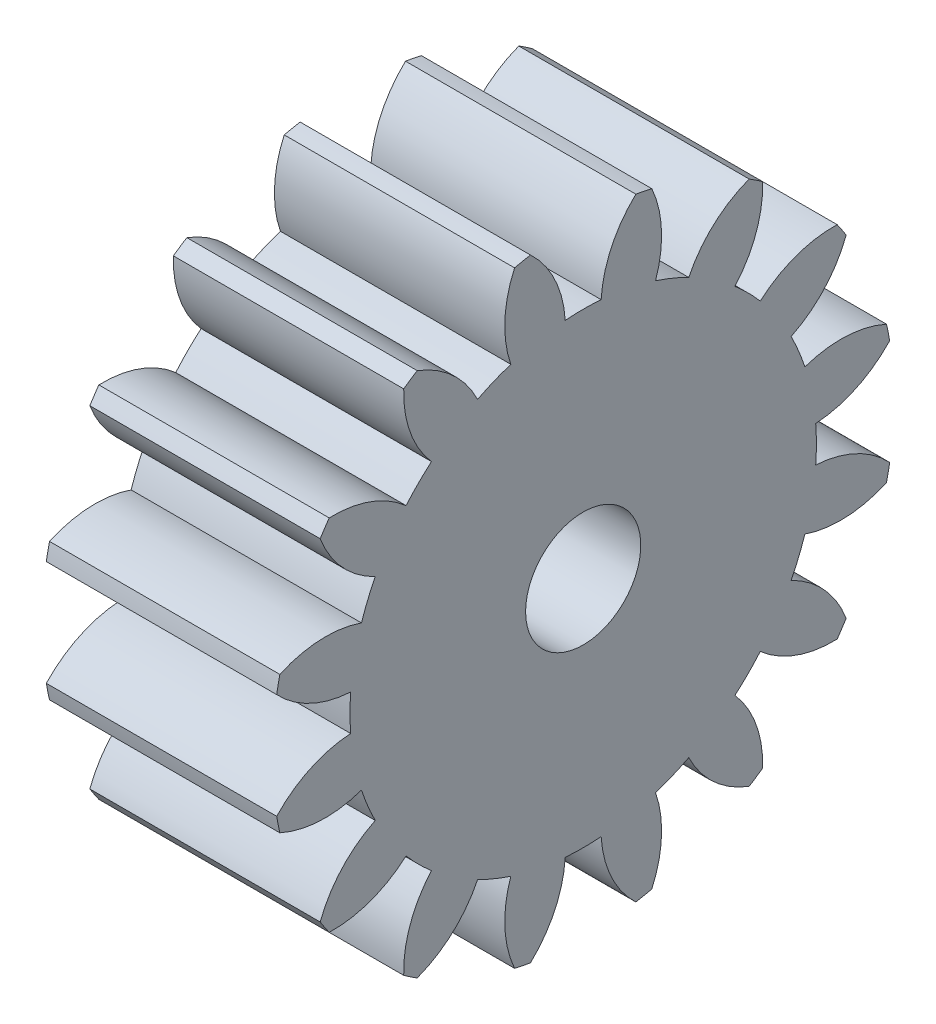
from build123d import *

# Parameters (mm, degrees)
BASPROSKE_W     = 10
BASPROSKE_H     = 13.5
TOOTHCUT_DEPTH  = 22.552262062
TEETHCUTS_COUNT = 16
TEETHCUTS_ANGLE = 337.5
BORSKE_R        = 2.5
BORE_DEPTH      = 50.0000508


with BuildPart() as part:
    # BasProSke → Base-Revolve (revolve)
    with BuildSketch(Plane(origin=(0, 0, 0), x_dir=(1, 0, 0), z_dir=(0, 1, 0)), mode=Mode.PRIVATE) as base_revolve_sk:
        with Locations((5, 6.75)):
            Rectangle(BASPROSKE_W, BASPROSKE_H)
    revolve(base_revolve_sk.sketch.rotate(Axis((-10, 0, 0), (1, 0, 0)), 180), axis=Axis((-10, 0, 0), (1, 0, 0)))

    # TooCutSke → ToothCut (cut, through all)
    with BuildSketch(Plane(origin=(0, 0, 0), x_dir=(0, 0, -1), z_dir=(1, 0, 0))):
        with BuildLine():
            ThreePointArc((0.779807897, 10.093922708), (0, 10.124), (-0.779807897, 10.093922708))
            ThreePointArc((-0.779807897, 10.093922708), (-1.232785697, 11.858156262), (-2.310463203, 13.326597651))
            ThreePointArc((-2.310463203, 13.326597651), (0, 13.5254), (2.310463203, 13.326597651))
            ThreePointArc((2.310463203, 13.326597651), (1.232785697, 11.858156262), (0.779807897, 10.093922708))
        make_face()
    toothcut = extrude(amount=TOOTHCUT_DEPTH, mode=Mode.SUBTRACT)

    # TeethCuts: ToothCut ×16 about axis
    teethcuts_axis = Axis((-10, 0, 0), (1, 0, 0))
    for i in range(1, TEETHCUTS_COUNT):
        add(toothcut.rotate(teethcuts_axis, i * TEETHCUTS_ANGLE / (TEETHCUTS_COUNT - 1)), mode=Mode.SUBTRACT)

    # BorSke → Bore (cut, symmetric)
    with BuildSketch(Plane(origin=(0, 0, 0), x_dir=(0, 0, -1), z_dir=(1, 0, 0))):
        with Locations(Location((0, 0, 0), (0, 0, 180))):
            Circle(BORSKE_R)
    extrude(amount=BORE_DEPTH, both=True, mode=Mode.SUBTRACT)


solid = part.part
